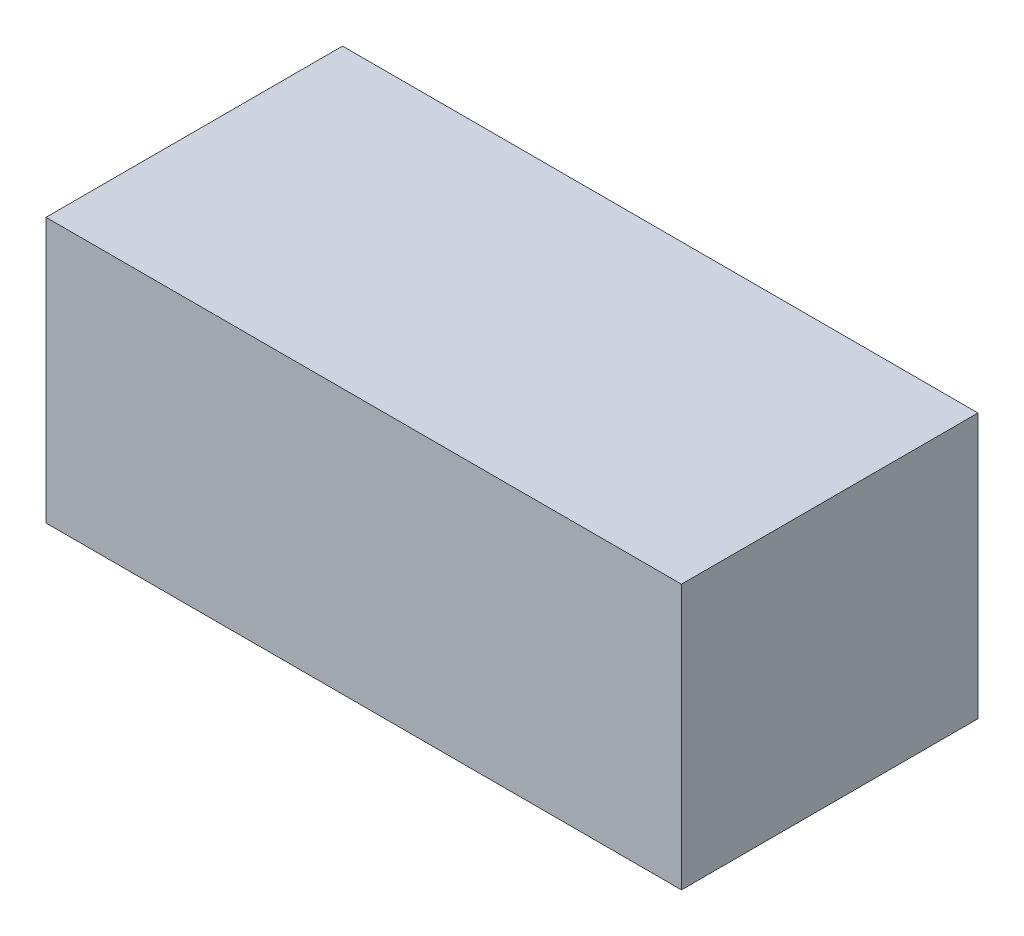
from build123d import *

# Parameters (mm, degrees)
BOSS_EXTRU_1_DEPTH = 25


with BuildPart() as part:
    # Esquisse1 → Boss.-Extru.1 (new body)
    with BuildSketch(Plane(origin=(0, 0, 0), x_dir=(1, 0, 0), z_dir=(0, 1, 0))):
        Polygon((-18.135135135, 11.114864865), (-13.135135135, 11.114864865), (36.864864865, 11.114864865), (41.864864865, 11.114864865), (41.864864865, -16.885135135), (36.864864865, -16.885135135), (-13.135135135, -16.885135135), (-18.135135135, -16.885135135), align=None)
    extrude(amount=BOSS_EXTRU_1_DEPTH)


solid = part.part
